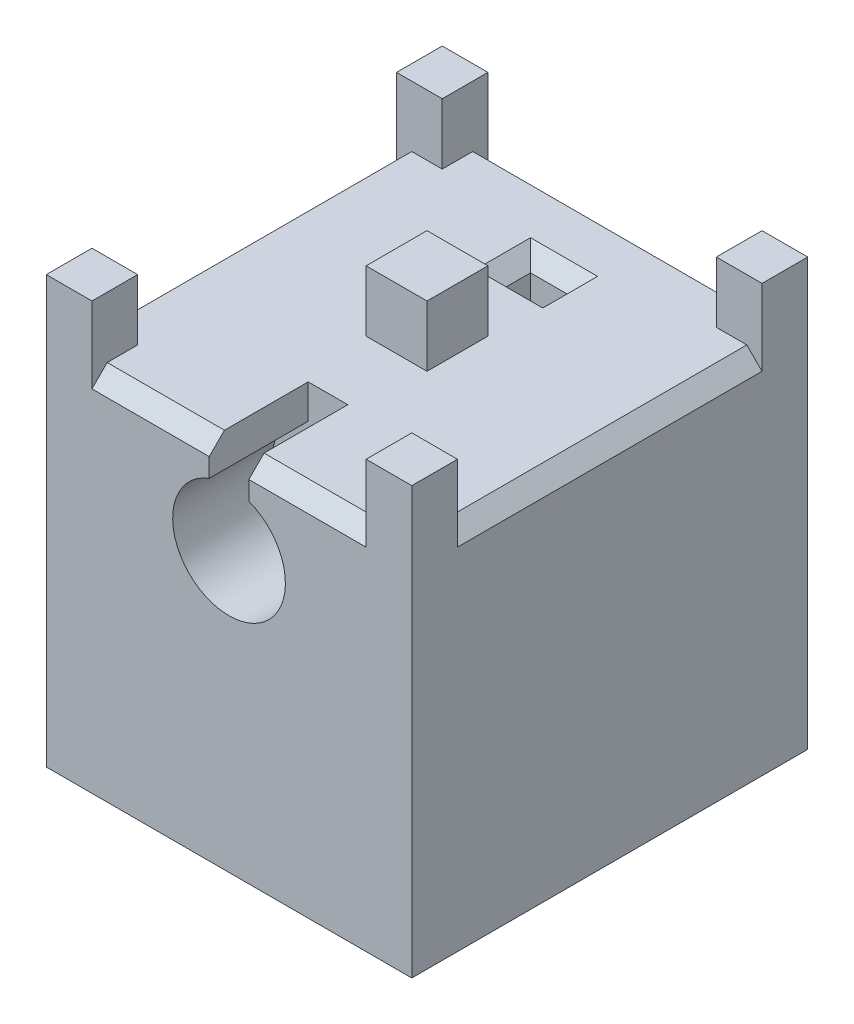
from build123d import *

# Parameters (mm, degrees)
SKETCH1_W           = 120
SKETCH1_H           = 120
BOSS_EXTRUDE2_DEPTH = 130
SKETCH20_W          = 12
SKETCH20_H          = 21.5
CUT_EXTRUDE3_DEPTH  = 33
SKETCH10_W          = 12
SKETCH10_H          = 8
CUT_EXTRUDE4_DEPTH  = 91
SKETCH2_R           = 18.5
CUT_EXTRUDE5_DEPTH  = 32.5
SKETCH24_W          = 15
SKETCH24_H          = 15
BOSS_EXTRUDE4_DEPTH = 20
SKETCH16_W          = 20
SKETCH16_H          = 20
BOSS_EXTRUDE5_DEPTH = 20
SKETCH27_W          = 15
SKETCH27_H          = 15
BOSS_EXTRUDE6_DEPTH = 20
SKETCH28_W          = 15
SKETCH28_H          = 15
BOSS_EXTRUDE7_DEPTH = 20
SKETCH29_W          = 15
SKETCH29_H          = 15
BOSS_EXTRUDE8_DEPTH = 20
CHAMFER3_SIZE       = 5
SKETCH38_W          = 13
SKETCH38_H          = 32.5
CUT_EXTRUDE7_DEPTH  = 30
CHAMFER4_SIZE       = 5


with BuildPart() as part:
    # Sketch1 → Boss-Extrude2 (new body)
    with BuildSketch(Plane.XY):
        with Locations((60, 60)):
            Rectangle(SKETCH1_W, SKETCH1_H)
    extrude(amount=-BOSS_EXTRUDE2_DEPTH)

    # Sketch20 → Cut-Extrude3 (cut)
    with BuildSketch(Plane(origin=(0, 0, -130), x_dir=(-1, 0, 0), z_dir=(0, 0, -1))):
        with Locations((-60, 28.25)):
            Rectangle(SKETCH20_W, SKETCH20_H)
    extrude(amount=-CUT_EXTRUDE3_DEPTH, mode=Mode.SUBTRACT)

    # Sketch10 → Cut-Extrude4 (cut)
    with BuildSketch(Plane(origin=(0, 120, 0), x_dir=(1, 0, 0), z_dir=(0, 1, 0))):
        with Locations((60, 101)):
            Rectangle(SKETCH10_W, SKETCH10_H)
    extrude(amount=-CUT_EXTRUDE4_DEPTH, mode=Mode.SUBTRACT)

    # Sketch2 → Cut-Extrude5 (cut)
    with BuildSketch(Plane.XY):
        with Locations((60, 91.5)):
            Circle(SKETCH2_R)
    extrude(amount=-CUT_EXTRUDE5_DEPTH, mode=Mode.SUBTRACT)

    # Sketch24 → Boss-Extrude4 (add)
    with BuildSketch(Plane(origin=(0, 120, 0), x_dir=(1, 0, 0), z_dir=(0, 1, 0))):
        with Locations((7.5, 122.5)):
            Rectangle(SKETCH24_W, SKETCH24_H)
    extrude(amount=BOSS_EXTRUDE4_DEPTH)

    # Sketch16 → Boss-Extrude5 (add)
    with BuildSketch(Plane(origin=(0, 120, 0), x_dir=(1, 0, 0), z_dir=(0, 1, 0))):
        with Locations((60, 65)):
            Rectangle(SKETCH16_W, SKETCH16_H)
    extrude(amount=BOSS_EXTRUDE5_DEPTH)

    # Sketch27 → Boss-Extrude6 (add)
    with BuildSketch(Plane(origin=(0, 120, 0), x_dir=(1, 0, 0), z_dir=(0, 1, 0))):
        with Locations((7.5, 7.5)):
            Rectangle(SKETCH27_W, SKETCH27_H)
    extrude(amount=BOSS_EXTRUDE6_DEPTH)

    # Sketch28 → Boss-Extrude7 (add)
    with BuildSketch(Plane(origin=(0, 120, 0), x_dir=(1, 0, 0), z_dir=(0, 1, 0))):
        with Locations((112.5, 122.5)):
            Rectangle(SKETCH28_W, SKETCH28_H)
    extrude(amount=BOSS_EXTRUDE7_DEPTH)

    # Sketch29 → Boss-Extrude8 (add)
    with BuildSketch(Plane(origin=(0, 120, 0), x_dir=(1, 0, 0), z_dir=(0, 1, 0))):
        with Locations((112.5, 7.5)):
            Rectangle(SKETCH29_W, SKETCH29_H)
    extrude(amount=BOSS_EXTRUDE8_DEPTH)

    # Chamfer3
    chamfer3_edges = [part.edges().sort_by_distance(p)[0] for p in [
        (60, 120, -97),
        (66, 120, -101),
        (60, 120, -105),
        (54, 120, -101),
    ]]
    chamfer(chamfer3_edges, length=CHAMFER3_SIZE)

    # Sketch38 → Cut-Extrude7 (cut)
    with BuildSketch(Plane(origin=(0, 120, 0), x_dir=(1, 0, 0), z_dir=(0, 1, 0))):
        with Locations((60, 16.25)):
            Rectangle(SKETCH38_W, SKETCH38_H)
    extrude(amount=-CUT_EXTRUDE7_DEPTH, mode=Mode.SUBTRACT)

    # Chamfer4
    chamfer4_edges = [part.edges().sort_by_distance(p)[0] for p in [
        (0, 120, -65),
        (60, 120, -130),
        (120, 120, -65),
        (85.75, 120, 0),
        (34.25, 120, 0),
    ]]
    chamfer(chamfer4_edges, length=CHAMFER4_SIZE)


solid = part.part
